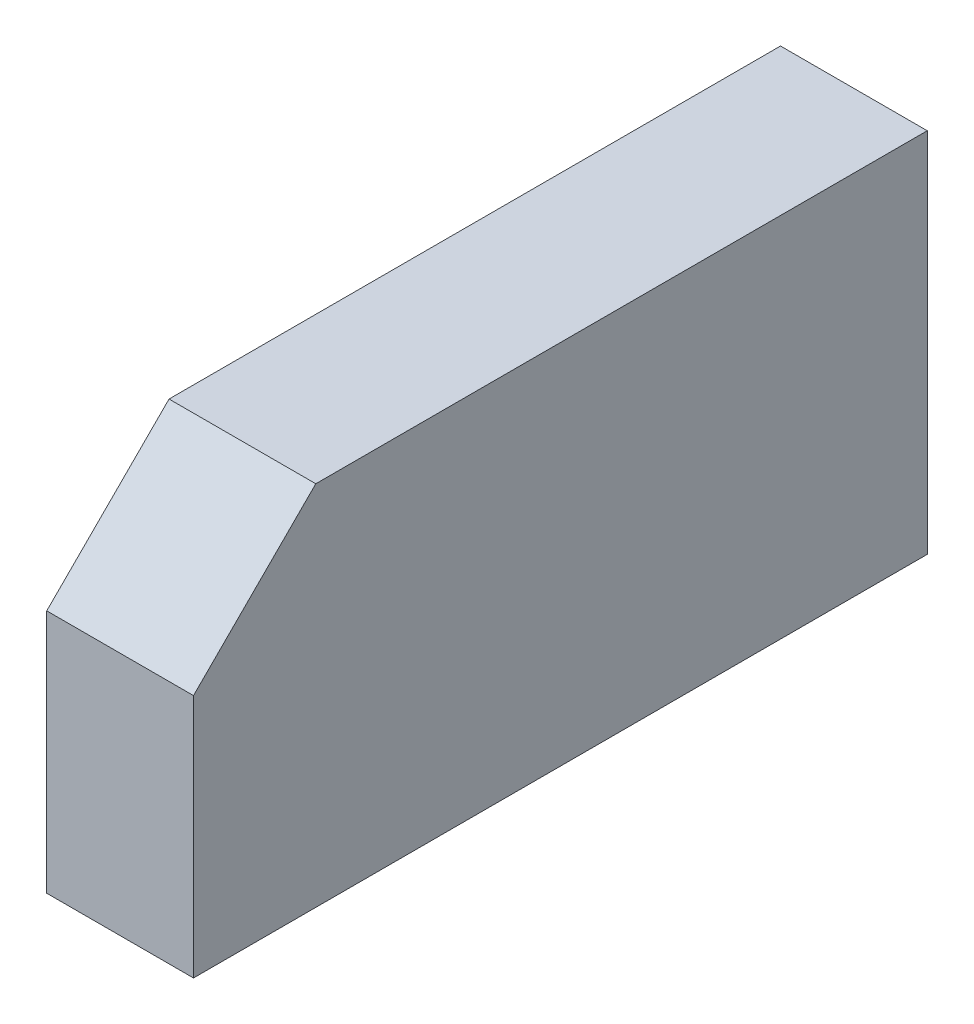
from build123d import *

# Parameters (mm, degrees)
SKETCH_1_W      = 6
SKETCH_1_H      = 30
EXTRUDE_1_DEPTH = 15
CHAMFER_1_SIZE  = 5


with BuildPart() as part:
    # Эскиз1 → Бобышка-Вытянуть1 (new body)
    with BuildSketch(Plane(origin=(0, 0, 0), x_dir=(1, 0, 0), z_dir=(0, 1, 0))):
        with Locations((3, 15)):
            Rectangle(SKETCH_1_W, SKETCH_1_H)
    extrude(amount=EXTRUDE_1_DEPTH)

    # Фаска1
    chamfer_1_edges = [part.edges().sort_by_distance(p)[0] for p in [
        (3, 15, 0),
    ]]
    chamfer(chamfer_1_edges, length=CHAMFER_1_SIZE)


solid = part.part
